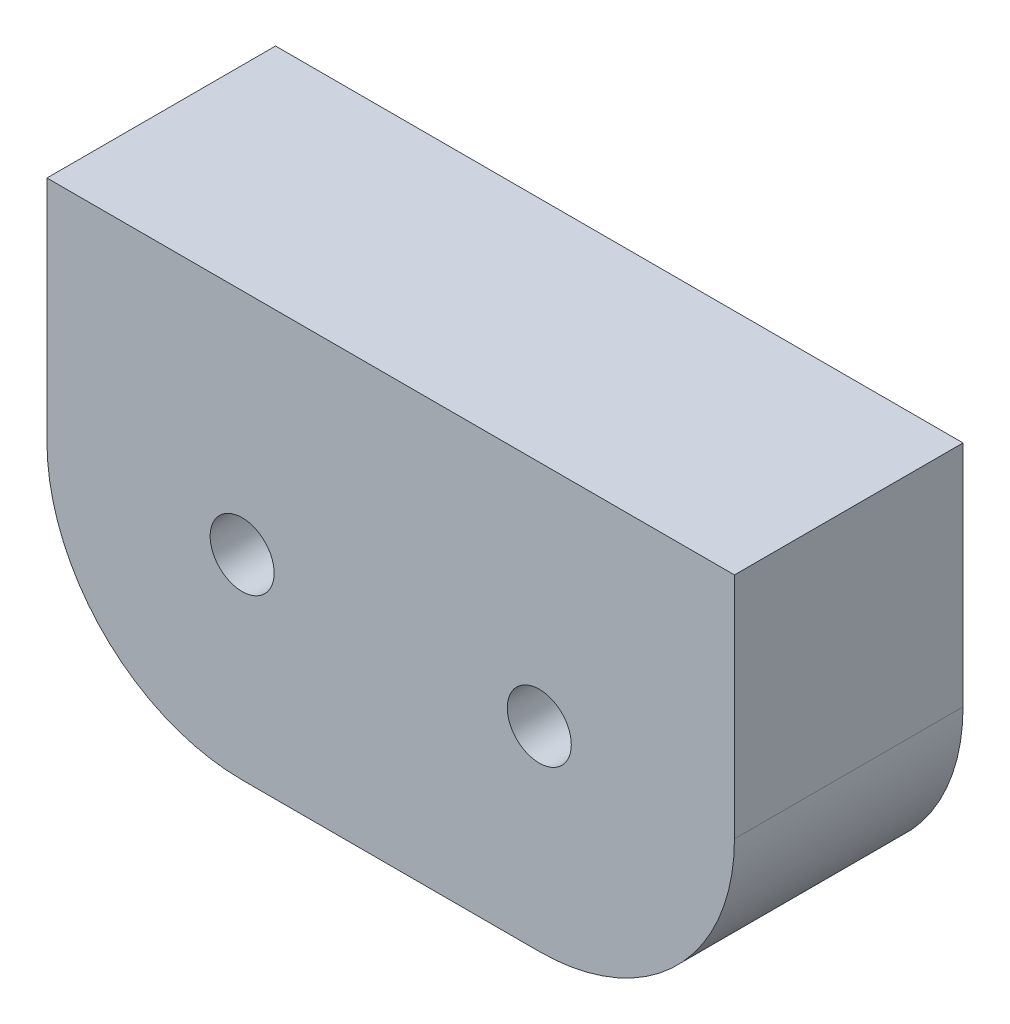
from build123d import *

# Parameters (mm, degrees)
SKETCH1_R           = 0.7
BOSS_EXTRUDE2_DEPTH = 5


with BuildPart() as part:
    # Sketch1 → Boss-Extrude2 (new body)
    with BuildSketch(Plane.XY):
        with BuildLine():
            Line((3.25, -6.019172648), (-3.25, -6.019172648))
            ThreePointArc((-3.25, -6.019172648), (-6.268760929, -4.768760929), (-7.519172648, -1.75))
            Line((-7.519172648, -1.75), (-7.519172648, 3.25))
            Line((-7.519172648, 3.25), (7.519172648, 3.25))
            Line((7.519172648, 3.25), (7.519172648, -1.75))
            ThreePointArc((7.519172648, -1.75), (6.268760929, -4.768760929), (3.25, -6.019172648))
        make_face()
        with Locations((-3.25, -1.75)):
            Circle(SKETCH1_R, mode=Mode.SUBTRACT)
        with Locations((3.25, -1.75)):
            Circle(SKETCH1_R, mode=Mode.SUBTRACT)
    extrude(amount=BOSS_EXTRUDE2_DEPTH)


solid = part.part
